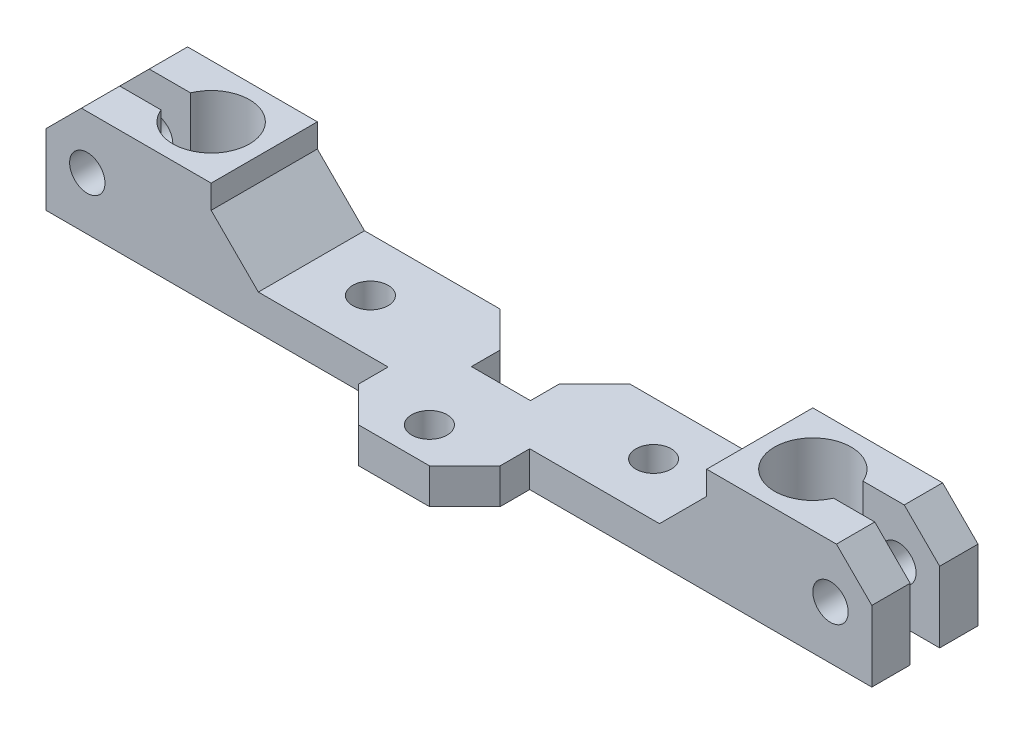
from build123d import *

# Parameters (mm, degrees)
BOSS_EXTRU_1_DEPTH      = 3
ESQUISSE2_W             = 14
ESQUISSE2_H             = 9
BOSS_EXTRU_2_DEPTH      = 6
ESQUISSE3_R             = 3.25
ENL_V_MAT_EXTRU_1_DEPTH = 50.69554375
CHANFREIN1_SIZE         = 4
ESQUISSE4_R             = 1.5
ENL_V_MAT_EXTRU_2_DEPTH = 50.240705403
ESQUISSE5_W             = 9.5
ESQUISSE5_H             = 2.5
ENL_V_MAT_EXTRU_3_DEPTH = 50.69554375
ESQUISSE6_R             = 1.5
ENL_V_MAT_EXTRU_4_DEPTH = 50.86789407
CHANFREIN2_SIZE         = 3
CHANFREIN3_SIZE         = 3
BOSS_EXTRU_3_START      = -2
BOSS_EXTRU_3_DEPTH      = 2


with BuildPart() as part:
    # Esquisse1 → Boss.-Extru.1 (new body)
    with BuildSketch(Plane(origin=(0, 0, 0), x_dir=(1, 0, 0), z_dir=(0, 1, 0))):
        Polygon((-21.783749016, 7.99000686), (10.716250984, 7.99000686), (10.716250984, 2.552277958), (15.716250984, 2.552277958), (15.716250984, 7.99000686), (48.216250984, 7.99000686), (48.216250984, -1.00999314), (19.216250984, -1.00999314), (19.216250984, -6.50999314), (7.216250984, -6.50999314), (7.216250984, -1.00999314), (-21.783749016, -1.00999314), align=None)
    extrude(amount=BOSS_EXTRU_1_DEPTH)

    # Esquisse2 → Boss.-Extru.2 (add)
    with BuildSketch(Plane(origin=(0, 3, 0), x_dir=(1, 0, 0), z_dir=(0, 1, 0))):
        with Locations((-14.783749016, 3.49000686)):
            Rectangle(ESQUISSE2_W, ESQUISSE2_H)
        with Locations((41.216250984, 3.49000686)):
            Rectangle(ESQUISSE2_W, ESQUISSE2_H)
    extrude(amount=BOSS_EXTRU_2_DEPTH)

    # Esquisse3 → Enlèv. mat.-Extru.1 (cut, through all)
    with BuildSketch(Plane(origin=(0, 9, 0), x_dir=(1, 0, 0), z_dir=(0, 1, 0))):
        with Locations(Location((-12.283749016, 3.49000686, 0), (0, 0, 270))):
            Circle(ESQUISSE3_R)
        with Locations(Location((38.716250984, 3.49000686, 0), (0, 0, 270))):
            Circle(ESQUISSE3_R)
    extrude(amount=-ENL_V_MAT_EXTRU_1_DEPTH, mode=Mode.SUBTRACT)

    # Chanfrein1
    chanfrein1_edges = [part.edges().sort_by_distance(p)[0] for p in [
        (-7.783749016, 3, -3.49000686),
        (34.216250984, 3, -3.49000686),
    ]]
    chamfer(chanfrein1_edges, length=CHANFREIN1_SIZE)

    # Esquisse4 → Enlèv. mat.-Extru.2 (cut, through all)
    with BuildSketch(Plane(origin=(0, 3, 0), x_dir=(1, 0, 0), z_dir=(0, 1, 0))):
        with Locations(Location((1.216250984, 3.49000686, 0), (0, 0, 270))):
            Circle(ESQUISSE4_R)
        with Locations(Location((25.216250984, 3.49000686, 0), (0, 0, 270))):
            Circle(ESQUISSE4_R)
        with Locations(Location((13.216250984, -3.50999314, 0), (0, 0, 270))):
            Circle(ESQUISSE4_R)
    extrude(amount=-ENL_V_MAT_EXTRU_2_DEPTH, mode=Mode.SUBTRACT)

    # Esquisse5 → Enlèv. mat.-Extru.3 (cut, through all)
    with BuildSketch(Plane(origin=(0, 9, 0), x_dir=(1, 0, 0), z_dir=(0, 1, 0))):
        with Locations((-17.033749016, 3.49000686)):
            Rectangle(ESQUISSE5_W, ESQUISSE5_H)
        with Locations((43.466250984, 3.49000686)):
            Rectangle(ESQUISSE5_W, ESQUISSE5_H)
    extrude(amount=-ENL_V_MAT_EXTRU_3_DEPTH, mode=Mode.SUBTRACT)

    # Esquisse6 → Enlèv. mat.-Extru.4 (cut, through all)
    with BuildSketch(Plane.XY.offset(1.00999314)):
        with Locations((-18.283749016, 4.5)):
            Circle(ESQUISSE6_R)
        with Locations((44.716250984, 4.5)):
            Circle(ESQUISSE6_R)
    extrude(amount=-ENL_V_MAT_EXTRU_4_DEPTH, mode=Mode.SUBTRACT)

    # Chanfrein2
    chanfrein2_edges = [part.edges().sort_by_distance(p)[0] for p in [
        (48.216250984, 9, -6.36500686),
        (-21.783749016, 9, -6.36500686),
        (48.216250984, 9, -0.61500686),
        (-21.783749016, 9, -0.61500686),
    ]]
    chamfer(chanfrein2_edges, length=CHANFREIN2_SIZE)

    # Chanfrein3
    chanfrein3_edges = [part.edges().sort_by_distance(p)[0] for p in [
        (19.216250984, 1.5, 6.50999314),
        (7.216250984, 1.5, 6.50999314),
        (15.716250984, 1.5, -7.99000686),
        (10.716250984, 1.5, -7.99000686),
    ]]
    chamfer(chanfrein3_edges, length=CHANFREIN3_SIZE)

    # Esquisse7 → Boss.-Extru.3 (add)
    with BuildSketch(Plane.XZ.offset(BOSS_EXTRU_3_START)):
        with BuildLine():
            Line((-10.399834705, -1.885766111), (-9.033749016, -3.49000686))
            ThreePointArc((-9.033749016, -3.49000686), (-11.646371576, -0.303119664), (-15.283749016, -2.24000686))
            Line((-15.283749016, -2.24000686), (-14.419216531, -2.24000686))
            ThreePointArc((-14.419216531, -2.24000686), (-12.500984788, -1.025147811), (-10.399834705, -1.885766111))
        make_face()
        with BuildLine():
            Line((-14.419216531, -4.74000686), (-15.283749016, -4.74000686))
            ThreePointArc((-15.283749016, -4.74000686), (-11.646371576, -6.676894056), (-9.033749016, -3.49000686))
            Line((-9.033749016, -3.49000686), (-10.399834705, -5.094247608))
            ThreePointArc((-10.399834705, -5.094247608), (-12.500984788, -5.954865908), (-14.419216531, -4.74000686))
        make_face()
        with BuildLine():
            ThreePointArc((41.716250984, -2.24000686), (38.078873545, -0.303119664), (35.466250984, -3.49000686))
            Line((35.466250984, -3.49000686), (36.832336674, -1.885766111))
            ThreePointArc((36.832336674, -1.885766111), (38.933486757, -1.025147811), (40.8517185, -2.24000686))
            Line((40.8517185, -2.24000686), (41.716250984, -2.24000686))
        make_face()
        with BuildLine():
            Line((36.832336674, -5.094247608), (35.466250984, -3.49000686))
            ThreePointArc((35.466250984, -3.49000686), (38.078873545, -6.676894056), (41.716250984, -4.74000686))
            Line((41.716250984, -4.74000686), (40.8517185, -4.74000686))
            ThreePointArc((40.8517185, -4.74000686), (38.933486757, -5.954865908), (36.832336674, -5.094247608))
        make_face()
    extrude(amount=BOSS_EXTRU_3_DEPTH)


solid = part.part
